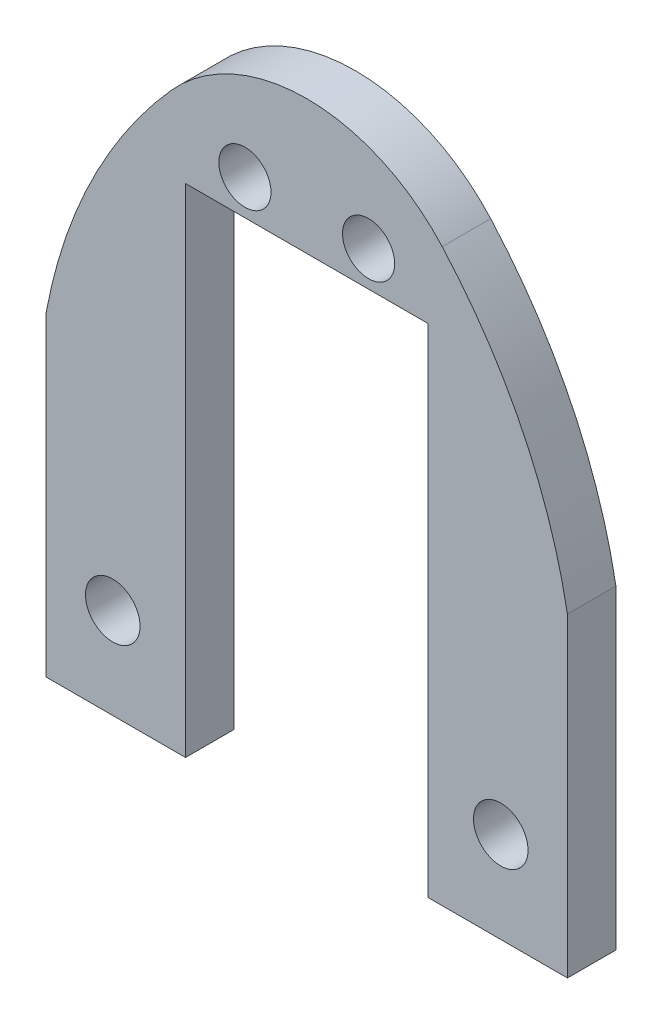
from build123d import *

# Parameters (mm, degrees)
ESQUISSE1_R             = 2.15
BOSS_EXTRU_1_DEPTH      = 4
ENL_V_MAT_EXTRU_1_DEPTH = 71.717748833
ENL_V_MAT_EXTRU_2_DEPTH = 68.644180707


with BuildPart() as part:
    # Esquisse1 → Boss.-Extru.1 (new body)
    with BuildSketch(Plane.XY):
        Polygon((0, 0), (0, 41), (-15, 56), (-28, 56), (-43, 41), (-43, 0), (-31.5, 0), (-31.5, 41), (-11.5, 41), (-11.5, 0), align=None)
        with Locations((-16.4, 43.9)):
            Circle(ESQUISSE1_R, mode=Mode.SUBTRACT)
        with Locations((-26.6, 43.9)):
            Circle(ESQUISSE1_R, mode=Mode.SUBTRACT)
    extrude(amount=BOSS_EXTRU_1_DEPTH)

    # Esquisse2 → Enlèv. mat.-Extru.1 (cut, through all)
    with BuildSketch(Plane.XY.offset(4)):
        with BuildLine():
            Line((0, 26), (0, 41))
            Line((0, 41), (-15, 56))
            Line((-15, 56), (-28, 56))
            Line((-28, 56), (-43, 41))
            Line((-43, 41), (-43, 26))
            ThreePointArc((-43, 26), (-39.293390462, 37.251091059), (-32.672201457, 47.073812699))
            ThreePointArc((-32.672201457, 47.073812699), (-21.5, 52.064721102), (-10.327798543, 47.073812699))
            ThreePointArc((-10.327798543, 47.073812699), (-3.706609538, 37.251091059), (0, 26))
        make_face()
    extrude(amount=-ENL_V_MAT_EXTRU_1_DEPTH, mode=Mode.SUBTRACT)

    # Esquisse3 → Enlèv. mat.-Extru.2 (cut, through all)
    with BuildSketch(Plane(origin=(0, 0, 0), x_dir=(-1, 0, 0), z_dir=(0, 0, -1))):
        with BuildLine():
            ThreePointArc((35.403723193, 6.682611752), (37.5, 5.25), (39.596276807, 6.682611752))
            ThreePointArc((39.596276807, 6.682611752), (37.5, 9.75), (35.403723193, 6.682611752))
        make_face()
        with BuildLine():
            ThreePointArc((7.596276807, 6.682611752), (5.5, 5.25), (3.403723193, 6.682611752))
            ThreePointArc((3.403723193, 6.682611752), (5.5, 9.75), (7.596276807, 6.682611752))
        make_face()
    extrude(amount=-ENL_V_MAT_EXTRU_2_DEPTH, mode=Mode.SUBTRACT)


solid = part.part
